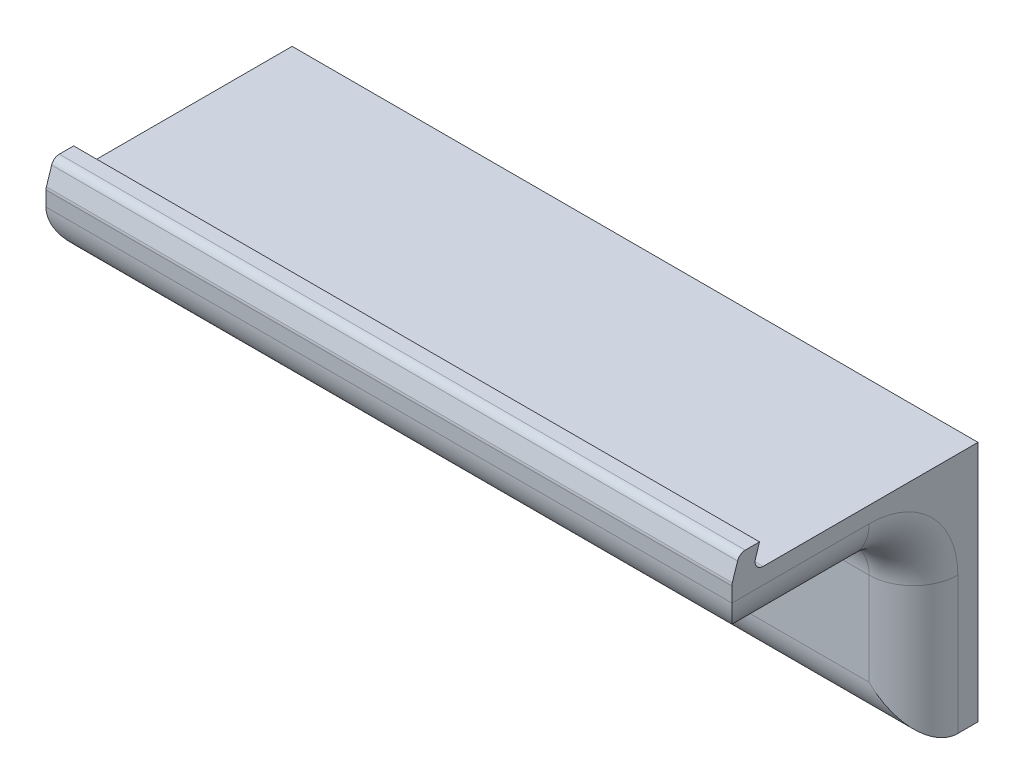
from build123d import *

# Parameters (mm, degrees)
SKETCH1_W                                       = 85
SKETCH1_H                                       = 30
BOSS_EXTRUDE1_DEPTH                             = 8
SKETCH2_W                                       = 85
SKETCH2_H                                       = 7.5
BOSS_EXTRUDE2_DEPTH                             = 22.5
CSK_FOR_M3_FLAT_HEAD_MACHINE_SCREW1_D           = 3.4
CSK_FOR_M3_FLAT_HEAD_MACHINE_SCREW1_CSINK_D     = 6.3
CSK_FOR_M3_FLAT_HEAD_MACHINE_SCREW1_CSINK_ANGLE = 90
BOSS_EXTRUDE3_DEPTH                             = 85
FILLET1_R                                       = 5.5
FILLET2_R                                       = 1
FILLET3_R                                       = 1


with BuildPart() as part:
    # Sketch1 → Boss-Extrude1 (new body)
    with BuildSketch(Plane.XY):
        Rectangle(SKETCH1_W, SKETCH1_H)
    extrude(amount=BOSS_EXTRUDE1_DEPTH)

    # Sketch2 → Boss-Extrude2 (add)
    with BuildSketch(Plane.XY.offset(8)):
        with Locations((0, 11.25)):
            Rectangle(SKETCH2_W, SKETCH2_H)
    extrude(amount=BOSS_EXTRUDE2_DEPTH)

    # CSK for M3 Flat Head Machine Screw1 (through all)
    with Locations(Plane.XY.offset(8)):
        with Locations((-22.5, -3.75), (22.5, -3.75)):
            CounterSinkHole(CSK_FOR_M3_FLAT_HEAD_MACHINE_SCREW1_D / 2, CSK_FOR_M3_FLAT_HEAD_MACHINE_SCREW1_CSINK_D / 2, counter_sink_angle=CSK_FOR_M3_FLAT_HEAD_MACHINE_SCREW1_CSINK_ANGLE)

    # Sketch7 → Boss-Extrude3 (add)
    with BuildSketch(Plane.ZY.offset(42.5)):
        Polygon((30.5, 15), (29.572949017, 17.853169549), (27.072949017, 17.853169549), (28, 15), align=None)
    extrude(amount=-BOSS_EXTRUDE3_DEPTH)

    # Fillet1
    fillet1_edges = [part.edges().sort_by_distance(p)[0] for p in [
        (0, -15, 8),
        (-42.5, -3.75, 8),
        (0, 7.5, 8),
        (-42.5, 7.5, 19.25),
        (42.5, 7.5, 19.25),
        (0, 7.5, 30.5),
        (42.5, -3.75, 8),
    ]]
    fillet(fillet1_edges, radius=FILLET1_R)

    # Fillet2
    fillet2_edges = [part.edges().sort_by_distance(p)[0] for p in [
        (0, 15, 28),
    ]]
    fillet(fillet2_edges, radius=FILLET2_R)

    # Fillet3
    fillet3_edges = [part.edges().sort_by_distance(p)[0] for p in [
        (0, 15, 30.5),
        (0, 17.853169549, 29.572949017),
    ]]
    fillet(fillet3_edges, radius=FILLET3_R)


solid = part.part
